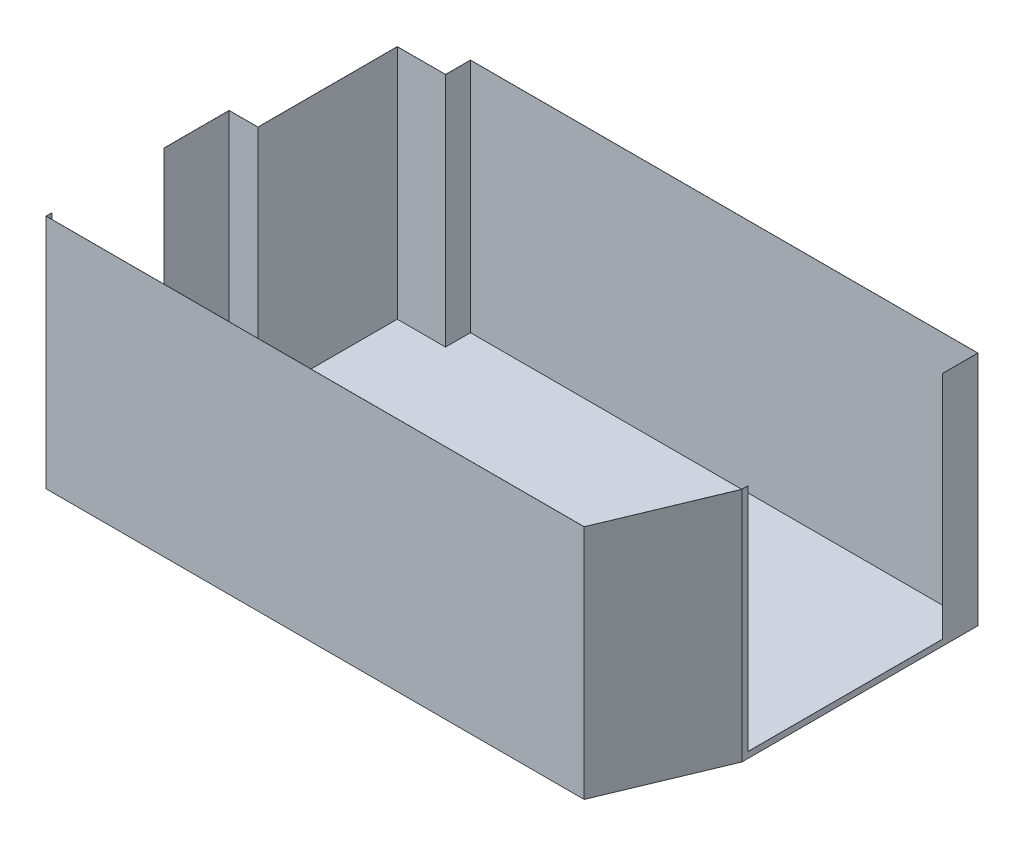
from build123d import *

# Parameters (mm, degrees)
SKETCH1_W            = 6000
SKETCH1_H            = 5000
BOSS_EXTRUDE1_DEPTH  = 1
SKETCH2_W            = 4560
SKETCH2_H            = 1
BOSS_EXTRUDE2_DEPTH  = 2000
SKETCH5_W            = 1
SKETCH5_H            = 50
BOSS_EXTRUDE5_DEPTH  = 2000
SKETCH6_W            = 1
SKETCH6_H            = 550
BOSS_EXTRUDE6_DEPTH  = 2000
SKETCH7_W            = 245
SKETCH7_H            = 1
BOSS_EXTRUDE9_DEPTH  = 2000
SKETCH8_W            = 1
SKETCH8_H            = 1180
BOSS_EXTRUDE10_DEPTH = 2000
SKETCH9_W            = 410
SKETCH9_H            = 1
BOSS_EXTRUDE11_DEPTH = 2000
SKETCH10_W           = 1
SKETCH10_H           = 210
BOSS_EXTRUDE12_DEPTH = 2000
SKETCH11_W           = 4300
SKETCH11_H           = 1
BOSS_EXTRUDE13_DEPTH = 2000
SKETCH12_W           = 1
SKETCH12_H           = 2000
BOSS_EXTRUDE14_DEPTH = 2000
BOSS_EXTRUDE16_DEPTH = 2000
SKETCH14_W           = 1650
SKETCH14_H           = 2000
CUT_EXTRUDE1_DEPTH   = 5898.983553724
CUT_EXTRUDE2_DEPTH   = 2000


with BuildPart() as part:
    # Sketch1 → Boss-Extrude1 (new body)
    with BuildSketch(Plane(origin=(0, 0, 0), x_dir=(1, 0, 0), z_dir=(0, 1, 0))):
        Rectangle(SKETCH1_W, SKETCH1_H)
    extrude(amount=BOSS_EXTRUDE1_DEPTH)

    # Sketch2 → Boss-Extrude2 (add)
    with BuildSketch(Plane(origin=(0, 1, 0), x_dir=(1, 0, 0), z_dir=(0, 1, 0))):
        with Locations((-720, -2499.5)):
            Rectangle(SKETCH2_W, SKETCH2_H)
    extrude(amount=BOSS_EXTRUDE2_DEPTH)

    # Sketch5 → Boss-Extrude5 (add)
    with BuildSketch(Plane(origin=(0, 1, 0), x_dir=(1, 0, 0), z_dir=(0, 1, 0))):
        with Locations((-2999.5, -2474)):
            Rectangle(SKETCH5_W, SKETCH5_H)
    extrude(amount=BOSS_EXTRUDE5_DEPTH)

    # Sketch6 → Boss-Extrude6 (add)
    with BuildSketch(Plane(origin=(0, 1, 0), x_dir=(1, 0, 0), z_dir=(0, 1, 0))):
        with Locations((-2999.5, -1224)):
            Rectangle(SKETCH6_W, SKETCH6_H)
    extrude(amount=BOSS_EXTRUDE6_DEPTH)

    # Sketch7 → Boss-Extrude9 (add)
    with BuildSketch(Plane(origin=(0, 1, 0), x_dir=(1, 0, 0), z_dir=(0, 1, 0))):
        with Locations((-2877.5, -948.5)):
            Rectangle(SKETCH7_W, SKETCH7_H)
    extrude(amount=BOSS_EXTRUDE9_DEPTH)

    # Sketch8 → Boss-Extrude10 (add)
    with BuildSketch(Plane(origin=(0, 1, 0), x_dir=(1, 0, 0), z_dir=(0, 1, 0))):
        with Locations((-2755.5, -358)):
            Rectangle(SKETCH8_W, SKETCH8_H)
    extrude(amount=BOSS_EXTRUDE10_DEPTH)

    # Sketch9 → Boss-Extrude11 (add)
    with BuildSketch(Plane(origin=(0, 1, 0), x_dir=(1, 0, 0), z_dir=(0, 1, 0))):
        with Locations((-2551, 232.5)):
            Rectangle(SKETCH9_W, SKETCH9_H)
    extrude(amount=BOSS_EXTRUDE11_DEPTH)

    # Sketch10 → Boss-Extrude12 (add)
    with BuildSketch(Plane(origin=(0, 1, 0), x_dir=(1, 0, 0), z_dir=(0, 1, 0))):
        with Locations((-2346.5, 338)):
            Rectangle(SKETCH10_W, SKETCH10_H)
    extrude(amount=BOSS_EXTRUDE12_DEPTH)

    # Sketch11 → Boss-Extrude13 (add)
    with BuildSketch(Plane(origin=(0, 1, 0), x_dir=(1, 0, 0), z_dir=(0, 1, 0))):
        with Locations((-197, 443.5)):
            Rectangle(SKETCH11_W, SKETCH11_H)
    extrude(amount=BOSS_EXTRUDE13_DEPTH)

    # Sketch12 → Boss-Extrude14 (add)
    with BuildSketch(Plane(origin=(0, 1, 0), x_dir=(1, 0, 0), z_dir=(0, 1, 0))):
        with Locations((1953.5, -556)):
            Rectangle(SKETCH12_W, SKETCH12_H)
    extrude(amount=BOSS_EXTRUDE14_DEPTH)

    # Sketch13 → Boss-Extrude16 (add)
    with BuildSketch(Plane(origin=(0, 1, 0), x_dir=(1, 0, 0), z_dir=(0, 1, 0))):
        Polygon((1954, -1556), (1560, -2500), (1560, -2499), (1953, -1556), align=None)
    extrude(amount=BOSS_EXTRUDE16_DEPTH)

    # Sketch14 → Cut-Extrude1 (cut, through all)
    with BuildSketch(Plane.ZY.offset(-1953)):
        with Locations((681, 1051)):
            Rectangle(SKETCH14_W, SKETCH14_H)
    extrude(amount=-CUT_EXTRUDE1_DEPTH, mode=Mode.SUBTRACT)

    # Sketch15 → Cut-Extrude2 (cut)
    with BuildSketch(Plane(origin=(0, 1, 0), x_dir=(1, 0, 0), z_dir=(0, 1, 0))):
        Polygon((1560, -2500), (1954, -1556), (1954, 444), (-2347, 444), (-2347, 233), (-2756, 233), (-2756, -948), (-3000, -948), (-3000, 2500), (3000, 2500), (3000, -2500), align=None)
    extrude(amount=-CUT_EXTRUDE2_DEPTH, mode=Mode.SUBTRACT)


solid = part.part
